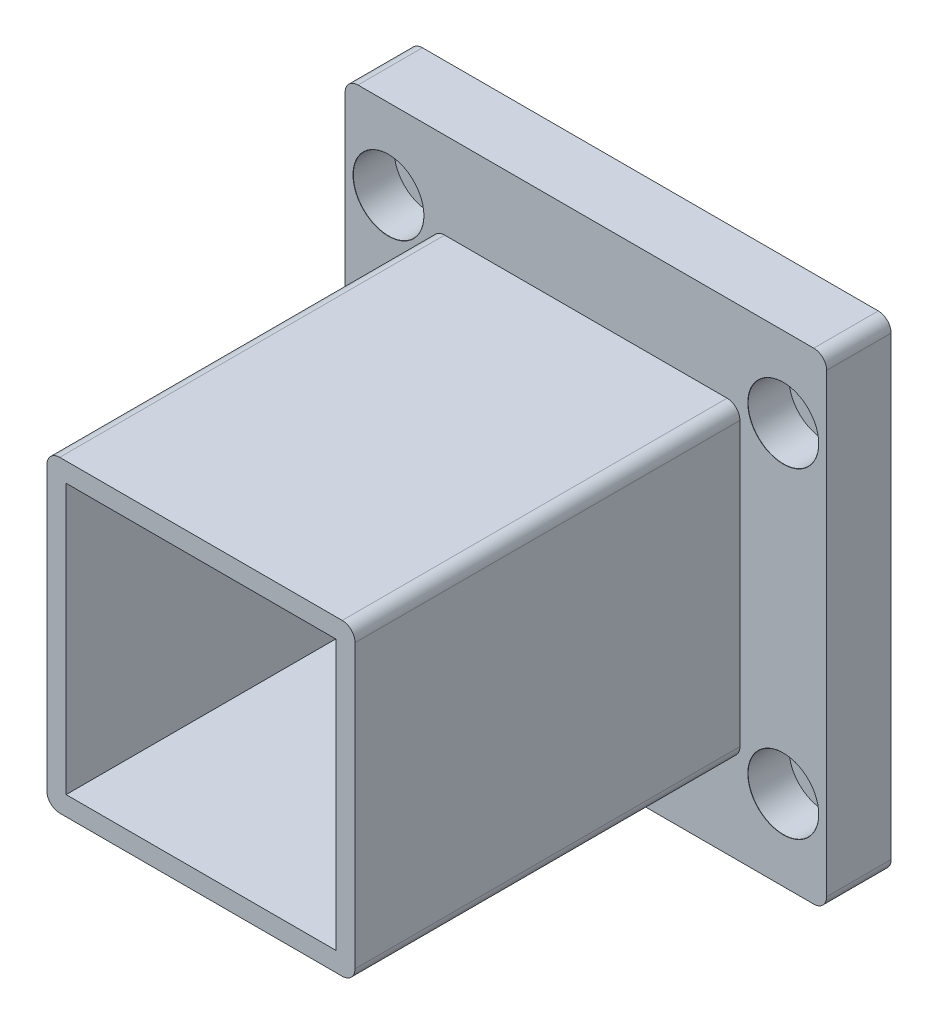
from build123d import *

# Parameters (mm, degrees)
SKETCH1_W                                    = 48
SKETCH1_H                                    = 48
SKETCH1_W_2                                  = 42
SKETCH1_H_2                                  = 42
BOSS_EXTRUDE1_DEPTH                          = 65
SKETCH3_W                                    = 75
SKETCH3_H                                    = 75
BOSS_EXTRUDE2_DEPTH                          = 5
SKETCH8_W                                    = 75
SKETCH8_H                                    = 75
SKETCH8_W_2                                  = 42
SKETCH8_H_2                                  = 42
BOSS_EXTRUDE3_DEPTH                          = 5.047079132
FILLET1_R                                    = 2
CBORE_FOR_M6_HEX_SOCKET_HEAD_CAP_SCR_2_COUNT = 2
CBORE_FOR_M6_HEX_SOCKET_HEAD_CAP_SCR_2_PITCH = 50
CBORE_FOR_M6_HEX_SOCKET_HEAD_CAP_SCR_3_COUNT = 2
CBORE_FOR_M6_HEX_SOCKET_HEAD_CAP_SCR_3_PITCH = 61.5
CBORE_FOR_M6_HEX_SOCKET_HEAD_CAP_SCR_4_COUNT = 2
CBORE_FOR_M6_HEX_SOCKET_HEAD_CAP_SCR_4_PITCH = 79.260645973


with BuildPart() as part:
    # Sketch1 → Boss-Extrude1 (new body)
    with BuildSketch(Plane(origin=(0, 0, 0), x_dir=(0, 1, 0), z_dir=(0, 0, 1))):
        with Locations((-1.048003873, 6.146094376)):
            Rectangle(SKETCH1_W, SKETCH1_H)
        with Locations((-1.048003873, 6.146094376)):
            Rectangle(SKETCH1_W_2, SKETCH1_H_2, mode=Mode.SUBTRACT)
    extrude(amount=BOSS_EXTRUDE1_DEPTH)

    # Sketch3 → Boss-Extrude2 (add)
    with BuildSketch(Plane(origin=(0, 0, 0), x_dir=(1, 0, 0), z_dir=(0, 0, -1))):
        with Locations((-6.146094376, 1.048003873)):
            Rectangle(SKETCH3_W, SKETCH3_H)
    extrude(amount=BOSS_EXTRUDE2_DEPTH)

    # Sketch8 → Boss-Extrude3 (add)
    with BuildSketch(Plane.XY):
        with Locations((-6.146094376, -1.048003873)):
            Rectangle(SKETCH8_W, SKETCH8_H)
        with Locations((-6.146094376, -1.048003873)):
            Rectangle(SKETCH8_W_2, SKETCH8_H_2, mode=Mode.SUBTRACT)
    extrude(amount=BOSS_EXTRUDE3_DEPTH)

    # Fillet1
    fillet1_edges = [part.edges().sort_by_distance(p)[0] for p in [
        (17.853905624, 22.951996127, 35.023539566),
        (17.853905624, -25.048003873, 35.023539566),
        (-30.146094376, -25.048003873, 35.023539566),
        (-30.146094376, 22.951996127, 35.023539566),
        (-43.646094376, -38.548003873, 0.023539566),
        (31.353905624, -38.548003873, 0.023539566),
        (31.353905624, 36.451996127, 0.023539566),
        (-43.646094376, 36.451996127, 0.023539566),
    ]]
    fillet(fillet1_edges, radius=FILLET1_R)

    # Sketch15 → CBORE for M6 Hex Socket Head Cap Screw2 (revolve, cut)
    with BuildSketch(Plane(origin=(-36.896094376, 23.951996127, 5.047079132), x_dir=(0, -1, 0), z_dir=(1, 0, 0))):
        Polygon((0, 0), (0, 10.047079132), (3.3, 10.047079132), (3.3, 6.4), (5.5, 6.4), (5.5, 0.025), (5.525, 0), align=None)
    cbore_for_m6_hex_socket_head_cap_screw2 = revolve(axis=Axis((-36.896094376, 23.951996127, 11.397079132), (0, 0, -1)), mode=Mode.SUBTRACT)

    # CBORE for M6 Hex Socket Head Cap Scr 2: CBORE for M6 Hex Socket Head Cap Screw2 ×2
    with Locations(*[(0, -i * CBORE_FOR_M6_HEX_SOCKET_HEAD_CAP_SCR_2_PITCH, 0) for i in range(1, CBORE_FOR_M6_HEX_SOCKET_HEAD_CAP_SCR_2_COUNT)]):
        add(cbore_for_m6_hex_socket_head_cap_screw2, mode=Mode.SUBTRACT)

    # CBORE for M6 Hex Socket Head Cap Scr 3: CBORE for M6 Hex Socket Head Cap Screw2 ×2
    with Locations(*[(i * CBORE_FOR_M6_HEX_SOCKET_HEAD_CAP_SCR_3_PITCH, 0, 0) for i in range(1, CBORE_FOR_M6_HEX_SOCKET_HEAD_CAP_SCR_3_COUNT)]):
        add(cbore_for_m6_hex_socket_head_cap_screw2, mode=Mode.SUBTRACT)

    # CBORE for M6 Hex Socket Head Cap Scr 4: CBORE for M6 Hex Socket Head Cap Screw2 ×2
    with Locations(*[Vector(0.7759210039901774, -0.63083008454486, 0) * (i * CBORE_FOR_M6_HEX_SOCKET_HEAD_CAP_SCR_4_PITCH) for i in range(1, CBORE_FOR_M6_HEX_SOCKET_HEAD_CAP_SCR_4_COUNT)]):
        add(cbore_for_m6_hex_socket_head_cap_screw2, mode=Mode.SUBTRACT)


solid = part.part
